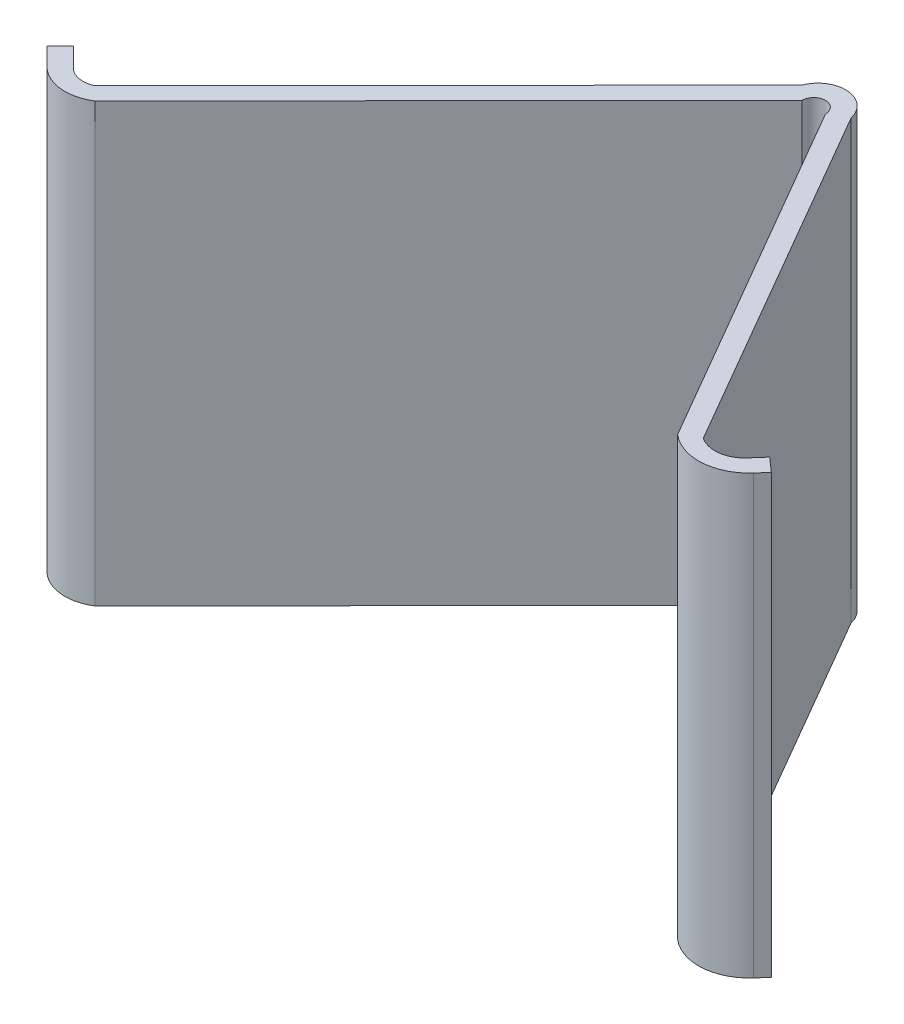
from build123d import *

# Parameters (mm, degrees)
EXTRUDE_1_DEPTH = 70


with BuildPart() as part:
    # 草圖1 → 填料-伸長1 (new body)
    with BuildSketch(Plane(origin=(0, 0, 0), x_dir=(1, 0, 0), z_dir=(0, 1, 0))):
        with BuildLine():
            Line((10.996587269, 18.037741282), (-45.487838574, -38.61479297))
            ThreePointArc((-45.487838574, -38.61479297), (-47.84934361, -38.895811815), (-49.888582931, -37.672218494))
            Line((-49.888582931, -37.672218494), (-52.721209644, -34.847997201))
            Line((-52.721209644, -34.847997201), (-54.839375613, -36.972467236))
            Line((-54.839375613, -36.972467236), (-52.0067489, -39.796688528))
            ThreePointArc((-52.0067489, -39.796688528), (-47.849605549, -41.783872953), (-43.363368539, -40.732958939))
            Line((-43.363368539, -40.732958939), (13.121057303, 15.919575313))
            ThreePointArc((13.121057303, 15.919575313), (15.009846467, 17.808364477), (16.898635631, 15.919575313))
            Line((16.898635631, 15.919575313), (49.482242531, -40.323722611))
            ThreePointArc((49.482242531, -40.323722611), (55.349857539, -42.316518092), (60.91576552, -39.592402078))
            Line((60.91576552, -39.592402078), (62.241081291, -38.094557591))
            Line((62.241081291, -38.094557591), (59.994314562, -36.106583934))
            Line((59.994314562, -36.106583934), (58.66899879, -37.60442842))
            ThreePointArc((58.66899879, -37.60442842), (55.618475046, -39.540333545), (52.078087051, -38.819863831))
            Line((52.078087051, -38.819863831), (19.494480151, 17.423434093))
            ThreePointArc((19.494480151, 17.423434093), (15.47366289, 20.886366054), (10.996587269, 18.037741282))
        make_face()
    extrude(amount=EXTRUDE_1_DEPTH)


solid = part.part
